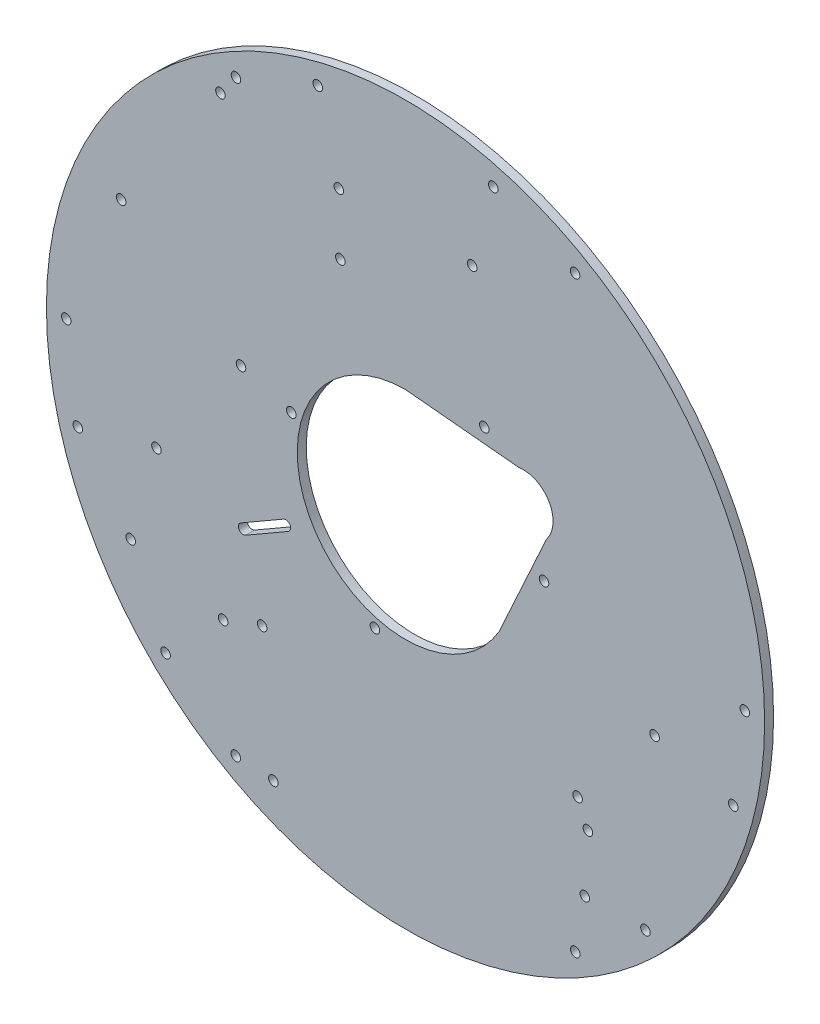
from build123d import *

# Parameters (mm, degrees)
SKETCH1_R           = 1.6
BOSS_EXTRUDE1_DEPTH = 3
SKETCH2_R           = 10
CUT_EXTRUDE1_DEPTH  = 178.200787705
BOSS_EXTRUDE2_DEPTH = 3
SKETCH4_R           = 1.6
CUT_EXTRUDE2_DEPTH  = 10
SKETCH5_R           = 1.6
CUT_EXTRUDE4_DEPTH  = 233.870824119
SKETCH6_R           = 1.6
CUT_EXTRUDE5_DEPTH  = 233.870824119


with BuildPart() as part:
    # Sketch1 → Boss-Extrude1 (new body)
    with BuildSketch(Plane.XY):
        Polygon((-65.110127969, 48.691011888), (-135.939165656, -73.988480037), (-113.05241431, -113.629496188), (28.605661063, -113.629496188), (51.492412409, -73.988480037), (-19.336625277, 48.691011888), align=None)
        with Locations((-15.850309664, -7.988480037)):
            Circle(SKETCH1_R, mode=Mode.SUBTRACT)
        with Locations((4.149690336, -42.629496188)):
            Circle(SKETCH1_R, mode=Mode.SUBTRACT)
        with Locations((-80.472087929, -36.060276806)):
            Circle(SKETCH1_R, mode=Mode.SUBTRACT)
        with Locations((-52.472087929, -84.557699418)):
            Circle(SKETCH1_R, mode=Mode.SUBTRACT)
        with BuildLine():
            Line((-42.223376623, -10.308988112), (-2.819220751, -14.058988112))
            ThreePointArc((-2.819220751, -14.058988112), (5.624526936, -18.933988112), (5.624526936, -28.683988112))
            Line((5.624526936, -28.683988112), (-10.829955736, -64.683988112))
            ThreePointArc((-10.829955736, -64.683988112), (-73.616797511, -64.683988112), (-42.223376623, -10.308988112))
        make_face(mode=Mode.SUBTRACT)
    extrude(amount=BOSS_EXTRUDE1_DEPTH)

    # Sketch2 → Cut-Extrude1 (cut, through all)
    with BuildSketch(Plane.XY.offset(3)):
        with Locations((-2.819220751, -23.808988112)):
            Circle(SKETCH2_R)
    extrude(amount=-CUT_EXTRUDE1_DEPTH, mode=Mode.SUBTRACT)

    # Sketch3 → Boss-Extrude2 (add)
    with BuildSketch(Plane.XY.offset(3)):
        with BuildLine():
            ThreePointArc((78.022043807, -46.558988112), (34.284577527, 46.206814241), (-65.110127969, 71.488281011))
            ThreePointArc((-65.110127969, 71.488281011), (-118.731330774, -139.324790466), (78.022043807, -46.558988112))
        make_face()
        Polygon((-135.939165656, -73.988480037), (-65.110127969, 48.691011888), (-19.336625277, 48.691011888), (51.492412409, -73.988480037), (28.605661063, -113.629496188), (-113.05241431, -113.629496188), align=None, mode=Mode.SUBTRACT)
    extrude(amount=-BOSS_EXTRUDE2_DEPTH)

    # Sketch4 → Cut-Extrude2 (cut)
    with BuildSketch(Plane(origin=(0, 0, 0), x_dir=(-1, 0, 0), z_dir=(0, 0, -1))):
        with Locations((-15.389294768, -99.586461705)):
            Circle(SKETCH4_R)
        with Locations((-17.802637284, -127.171092895)):
            Circle(SKETCH4_R)
        with Locations((86.467923808, -145.829873387)):
            Circle(SKETCH4_R)
        with Locations((64.041857466, 16.578685607)):
            Circle(SKETCH4_R)
        with Locations((97.309290774, -30.932132962)):
            Circle(SKETCH4_R)
        with Locations((104.180307636, 44.683930988)):
            Circle(SKETCH4_R)
        with Locations((137.447740944, -2.82688758)):
            Circle(SKETCH4_R)
        with Locations((90.232180337, -102.804224376)):
            Circle(SKETCH4_R)
    extrude(amount=-CUT_EXTRUDE2_DEPTH, mode=Mode.SUBTRACT)

    # Sketch5 → Cut-Extrude4 (cut, through all)
    with BuildSketch(Plane(origin=(0, 0, 0), x_dir=(-1, 0, 0), z_dir=(0, 0, -1))):
        with Locations((82.277051548, -69.683988112)):
            Circle(SKETCH5_R)
        with Locations((134.238575775, -99.683988112)):
            Circle(SKETCH5_R)
        with Locations((96.585864973, -77.945185395)):
            Circle(SKETCH5_R)
        Polygon((82.277051548, -69.683988112), (83.077051548, -68.298347466), (97.385864973, -76.559544749), (96.585864973, -77.945185395), (95.785864973, -79.330826041), (81.497868277, -71.081440591), align=None)
    extrude(amount=-CUT_EXTRUDE4_DEPTH, mode=Mode.SUBTRACT)

    # Sketch6 → Cut-Extrude5 (cut, through all)
    with BuildSketch(Plane(origin=(0, 0, 0), x_dir=(-1, 0, 0), z_dir=(0, 0, -1))):
        with Locations((155.831472002, -46.59864482)):
            Circle(SKETCH6_R)
        with Locations((151.955243084, -75.982080937)):
            Circle(SKETCH6_R)
        with Locations((125.615678054, -68.919488348)):
            Circle(SKETCH6_R)
        with Locations((103.284288585, -107.598589514)):
            Circle(SKETCH6_R)
        with Locations((122.570455698, -126.878025659)):
            Circle(SKETCH6_R)
        with Locations((99.061768029, -144.926656432)):
            Circle(SKETCH6_R)
        with Locations((98.993080596, 51.848336915)):
            Circle(SKETCH6_R)
        with Locations(Location((71.608164009, 63.183142259, 0), (0, 0, 180))):
            Circle(SKETCH6_R)
        with Locations((64.554766093, 36.841113525)):
            Circle(SKETCH6_R)
        with Locations((12.838589238, 63.183142259)):
            Circle(SKETCH6_R)
        with Locations((-14.546327349, 51.848336915)):
            Circle(SKETCH6_R)
        with Locations((19.891987154, 36.841113525)):
            Circle(SKETCH6_R)
        with Locations((-41.168924808, -68.919488348)):
            Circle(SKETCH6_R)
        with Locations((-67.508489837, -75.982080937)):
            Circle(SKETCH6_R)
        with Locations((-71.384718755, -46.59864482)):
            Circle(SKETCH6_R)
        with Locations((-38.123702451, -126.878025659)):
            Circle(SKETCH6_R)
        with Locations((-14.615014783, -144.926656432)):
            Circle(SKETCH6_R)
        with Locations((-18.837535338, -107.598589514)):
            Circle(SKETCH6_R)
    extrude(amount=-CUT_EXTRUDE5_DEPTH, mode=Mode.SUBTRACT)


solid = part.part
